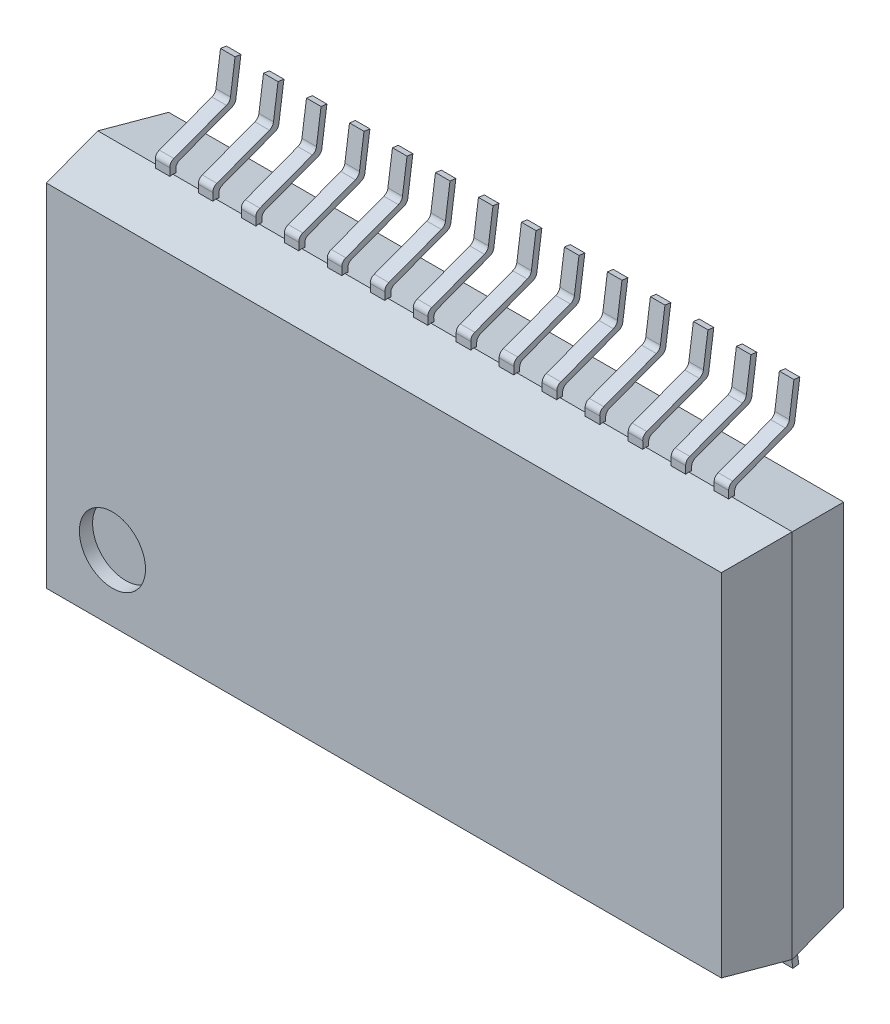
from build123d import *

# Parameters (mm, degrees)
ESBO_O1_W                  = 10.5
ESBO_O1_H                  = 5.6
EXTRUS_O1_DEPTH            = 0.925
EXTRUS_O1_TAPER            = 9
ESBO_O2_W                  = 10.5
ESBO_O2_H                  = 5.6
EXTRUS_O2_DEPTH            = 0.925
EXTRUS_O2_DRAFT            = -9
EXTRUS_O3_DEPTH            = 0.22
EXTRUS_O3_2_DEPTH          = 0.22
PADR_O_LINEAR2_COUNT       = 14
PADR_O_LINEAR2_PITCH       = 0.65
CORTE_EXTRUS_O1_DEPTH      = 0.2
CORTE_EXTRUS_O1_DEPTH_BACK = 0.2
CORTE_EXTRUS_O1_START      = 0.925
ESBO_O7_R                  = 0.5


with BuildPart() as part:
    # Esboço1 → Extrusão1 (new body)
    with BuildSketch(Plane.XY):
        with Locations((4.335, 2.8)):
            Rectangle(ESBO_O1_W, ESBO_O1_H)
    extrude(amount=EXTRUS_O1_DEPTH, taper=EXTRUS_O1_TAPER)

    # Esboço7 → Corte-extrusão1 (cut, two sides: drawn at the far end of the back side and taken through both)
    with BuildSketch(Plane.XY.offset(CORTE_EXTRUS_O1_START - CORTE_EXTRUS_O1_DEPTH_BACK)):
        with Locations((0.231505607, 1.146505607)):
            Circle(ESBO_O7_R)
    extrude(amount=CORTE_EXTRUS_O1_DEPTH + CORTE_EXTRUS_O1_DEPTH_BACK, mode=Mode.SUBTRACT)


with BuildPart() as body_2:
    # Esboço2 → Extrusão2 (with draft: the straight prism first)
    with BuildSketch(Plane.XY):
        with Locations((4.335, 2.8)):
            Rectangle(ESBO_O2_W, ESBO_O2_H)
    extrude(amount=-EXTRUS_O2_DEPTH)
    # Extrusão2: the draft: its side faces are tilted about the plane it starts from
    extrus_o2_sides = [body_2.faces().sort_by_distance(p)[0] for p in [
        (-0.915, 2.8, -0.4625),
        (4.335, 0, -0.4625),
        (9.585, 2.8, -0.4625),
        (4.335, 5.6, -0.4625),
    ]]
    draft(extrus_o2_sides, Plane.XY, EXTRUS_O2_DRAFT)


with BuildPart() as body_3:
    # Esboço3 → Extrusão3 (new body)
    with BuildSketch(Plane(origin=(0, 0, 0), x_dir=(0, 0, -1), z_dir=(1, 0, 0))):
        with BuildLine():
            Line((1.029662919, 6.653771186), (0.940538793, 6.666296766))
            Line((0.940538793, 6.666296766), (0.871516591, 6.175178279))
            ThreePointArc((0.871516591, 6.175178279), (0.852356799, 6.126723206), (0.810067904, 6.096282425))
            Line((0.810067904, 6.096282425), (0.016064054, 5.797421437))
            ThreePointArc((0.016064054, 5.797421437), (-0.030606428, 5.762345875), (-0.045, 5.70576625))
            Line((-0.045, 5.70576625), (-0.045, 5.5928727))
            Line((-0.045, 5.5928727), (0, 5.6))
            Line((0, 5.6), (0.045, 5.5928727))
            Line((0.045, 5.5928727), (0.045, 5.643477742))
            ThreePointArc((0.045, 5.643477742), (0.059393572, 5.700057367), (0.106064054, 5.735132929))
            Line((0.106064054, 5.735132929), (0.894945613, 6.0320659))
            ThreePointArc((0.894945613, 6.0320659), (0.933194418, 6.060280039), (0.95236546, 6.103771186))
            Line((0.95236546, 6.103771186), (1.029662919, 6.653771186))
        make_face()
    extrude(amount=EXTRUS_O3_DEPTH)


with BuildPart() as body_4:
    # Esboço3 → Extrus_o3 2 (new body)
    with BuildSketch(Plane(origin=(0, 0, 0), x_dir=(0, 0, -1), z_dir=(1, 0, 0))):
        with BuildLine():
            Line((0, 0), (0.045, 0.0071273))
            Line((0.045, 0.0071273), (0.045, -0.072044213))
            ThreePointArc((0.045, -0.072044213), (0.065130784, -0.092886186), (0.090945314, -0.106048493))
            Line((0.090945314, -0.106048493), (0.879826872, -0.402981464))
            ThreePointArc((0.879826872, -0.402981464), (0.918075678, -0.431195603), (0.937246719, -0.474686751))
            Line((0.937246719, -0.474686751), (1.014544178, -1.024686751))
            Line((1.014544178, -1.024686751), (0.925420052, -1.03721233))
            Line((0.925420052, -1.03721233), (0.85639785, -0.546093843))
            ThreePointArc((0.85639785, -0.546093843), (0.837238058, -0.49763877), (0.794949163, -0.467197989))
            Line((0.794949163, -0.467197989), (0.000945314, -0.168337001))
            ThreePointArc((0.000945314, -0.168337001), (-0.024869216, -0.155174694), (-0.045, -0.134332721))
            Line((-0.045, -0.134332721), (-0.045, 0.0071273))
            Line((-0.045, 0.0071273), (0, 0))
        make_face()
    extrude(amount=EXTRUS_O3_2_DEPTH)


with BuildPart() as padr_o_linear2_1:
    # Padrão linear2: pattern copy
    add(body_4.part.moved(Location(Vector(1, 0, 0) * (1 * PADR_O_LINEAR2_PITCH))))


with BuildPart() as padr_o_linear2_2:
    # Padrão linear2: pattern copy
    add(body_4.part.moved(Location(Vector(1, 0, 0) * (2 * PADR_O_LINEAR2_PITCH))))


with BuildPart() as padr_o_linear2_3:
    # Padrão linear2: pattern copy
    add(body_4.part.moved(Location(Vector(1, 0, 0) * (3 * PADR_O_LINEAR2_PITCH))))


with BuildPart() as padr_o_linear2_4:
    # Padrão linear2: pattern copy
    add(body_4.part.moved(Location(Vector(1, 0, 0) * (4 * PADR_O_LINEAR2_PITCH))))


with BuildPart() as padr_o_linear2_5:
    # Padrão linear2: pattern copy
    add(body_4.part.moved(Location(Vector(1, 0, 0) * (5 * PADR_O_LINEAR2_PITCH))))


with BuildPart() as padr_o_linear2_6:
    # Padrão linear2: pattern copy
    add(body_4.part.moved(Location(Vector(1, 0, 0) * (6 * PADR_O_LINEAR2_PITCH))))


with BuildPart() as padr_o_linear2_7:
    # Padrão linear2: pattern copy
    add(body_4.part.moved(Location(Vector(1, 0, 0) * (7 * PADR_O_LINEAR2_PITCH))))


with BuildPart() as padr_o_linear2_8:
    # Padrão linear2: pattern copy
    add(body_4.part.moved(Location(Vector(1, 0, 0) * (8 * PADR_O_LINEAR2_PITCH))))


with BuildPart() as padr_o_linear2_9:
    # Padrão linear2: pattern copy
    add(body_4.part.moved(Location(Vector(1, 0, 0) * (9 * PADR_O_LINEAR2_PITCH))))


with BuildPart() as padr_o_linear2_10:
    # Padrão linear2: pattern copy
    add(body_4.part.moved(Location(Vector(1, 0, 0) * (10 * PADR_O_LINEAR2_PITCH))))


with BuildPart() as padr_o_linear2_11:
    # Padrão linear2: pattern copy
    add(body_4.part.moved(Location(Vector(1, 0, 0) * (11 * PADR_O_LINEAR2_PITCH))))


with BuildPart() as padr_o_linear2_12:
    # Padrão linear2: pattern copy
    add(body_4.part.moved(Location(Vector(1, 0, 0) * (12 * PADR_O_LINEAR2_PITCH))))


with BuildPart() as padr_o_linear2_13:
    # Padrão linear2: pattern copy
    add(body_4.part.moved(Location(Vector(1, 0, 0) * (13 * PADR_O_LINEAR2_PITCH))))


with BuildPart() as padr_o_linear2_14:
    # Padrão linear2: pattern copy
    add(body_3.part.moved(Location(Vector(1, 0, 0) * (1 * PADR_O_LINEAR2_PITCH))))


with BuildPart() as padr_o_linear2_15:
    # Padrão linear2: pattern copy
    add(body_3.part.moved(Location(Vector(1, 0, 0) * (2 * PADR_O_LINEAR2_PITCH))))


with BuildPart() as padr_o_linear2_16:
    # Padrão linear2: pattern copy
    add(body_3.part.moved(Location(Vector(1, 0, 0) * (3 * PADR_O_LINEAR2_PITCH))))


with BuildPart() as padr_o_linear2_17:
    # Padrão linear2: pattern copy
    add(body_3.part.moved(Location(Vector(1, 0, 0) * (4 * PADR_O_LINEAR2_PITCH))))


with BuildPart() as padr_o_linear2_18:
    # Padrão linear2: pattern copy
    add(body_3.part.moved(Location(Vector(1, 0, 0) * (5 * PADR_O_LINEAR2_PITCH))))


with BuildPart() as padr_o_linear2_19:
    # Padrão linear2: pattern copy
    add(body_3.part.moved(Location(Vector(1, 0, 0) * (6 * PADR_O_LINEAR2_PITCH))))


with BuildPart() as padr_o_linear2_20:
    # Padrão linear2: pattern copy
    add(body_3.part.moved(Location(Vector(1, 0, 0) * (7 * PADR_O_LINEAR2_PITCH))))


with BuildPart() as padr_o_linear2_21:
    # Padrão linear2: pattern copy
    add(body_3.part.moved(Location(Vector(1, 0, 0) * (8 * PADR_O_LINEAR2_PITCH))))


with BuildPart() as padr_o_linear2_22:
    # Padrão linear2: pattern copy
    add(body_3.part.moved(Location(Vector(1, 0, 0) * (9 * PADR_O_LINEAR2_PITCH))))


with BuildPart() as padr_o_linear2_23:
    # Padrão linear2: pattern copy
    add(body_3.part.moved(Location(Vector(1, 0, 0) * (10 * PADR_O_LINEAR2_PITCH))))


with BuildPart() as padr_o_linear2_24:
    # Padrão linear2: pattern copy
    add(body_3.part.moved(Location(Vector(1, 0, 0) * (11 * PADR_O_LINEAR2_PITCH))))


with BuildPart() as padr_o_linear2_25:
    # Padrão linear2: pattern copy
    add(body_3.part.moved(Location(Vector(1, 0, 0) * (12 * PADR_O_LINEAR2_PITCH))))


with BuildPart() as padr_o_linear2_26:
    # Padrão linear2: pattern copy
    add(body_3.part.moved(Location(Vector(1, 0, 0) * (13 * PADR_O_LINEAR2_PITCH))))


solid = Compound([part.part, body_2.part, body_3.part, body_4.part, padr_o_linear2_1.part, padr_o_linear2_2.part, padr_o_linear2_3.part, padr_o_linear2_4.part, padr_o_linear2_5.part, padr_o_linear2_6.part, padr_o_linear2_7.part, padr_o_linear2_8.part, padr_o_linear2_9.part, padr_o_linear2_10.part, padr_o_linear2_11.part, padr_o_linear2_12.part, padr_o_linear2_13.part, padr_o_linear2_14.part, padr_o_linear2_15.part, padr_o_linear2_16.part, padr_o_linear2_17.part, padr_o_linear2_18.part, padr_o_linear2_19.part, padr_o_linear2_20.part, padr_o_linear2_21.part, padr_o_linear2_22.part, padr_o_linear2_23.part, padr_o_linear2_24.part, padr_o_linear2_25.part, padr_o_linear2_26.part])
